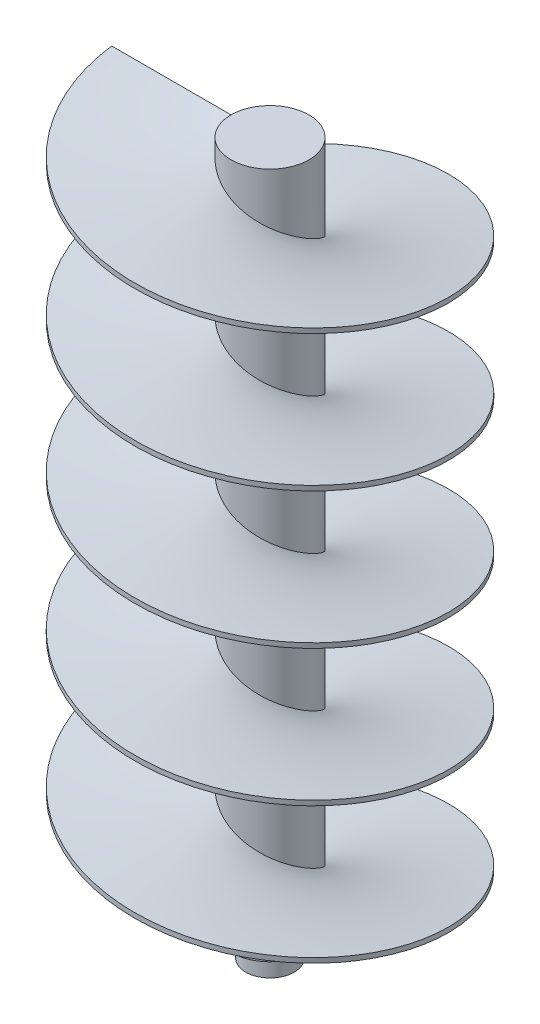
from build123d import *

# Parameters (mm, degrees)
SWEEP_1_PITCH       = 28
SWEEP_1_HEIGHT      = 140
SWEEP_1_RADIUS      = 32.5
SWEEP_1_START_ANGLE = -90
SKETCH_5_W          = 25
SKETCH_5_H          = 1
SKETCH_6_R          = 8
EXTRUDE_1_DEPTH     = 140
EXTRUDE_START       = 1
SKETCH_7_R          = 8
EXTRUDE_2_DEPTH     = 1
SKETCH_8_R          = 5
EXTRUDE_3_DEPTH     = 5


with BuildPart() as part:
    # 掃出1: sweep along a helix
    with BuildLine() as sweep_1_path:
        add(Helix(SWEEP_1_PITCH, SWEEP_1_HEIGHT, SWEEP_1_RADIUS, center=(0, 0, 0), direction=(0, 1, 0), lefthand=True, mode=Mode.PRIVATE).rotate(Axis((0, 0, 0), (0, 1, 0)), SWEEP_1_START_ANGLE))
    # 草圖5 → 掃出1 (sweep)
    with BuildSketch(Plane.XY):
        with Locations((-19.999998388, 139.498603549)):
            Rectangle(SKETCH_5_W, SKETCH_5_H)
    sweep(path=sweep_1_path.line, is_frenet=True)

    # 草圖6 → 填料-伸長1 (add)
    with BuildSketch(Plane(origin=(0, 0, 0), x_dir=(1, 0, 0), z_dir=(0, 1, 0))):
        with Locations(Location((0, 0, 0), (0, 0, 167.135626373))):
            Circle(SKETCH_6_R)
    extrude(amount=EXTRUDE_1_DEPTH)

    # 草圖7 → 填料-伸長2 (add)
    with BuildSketch(Plane.XZ.offset(EXTRUDE_START)):
        with Locations(Location((0, 0, 0), (0, 0, 180.018077006))):
            Circle(SKETCH_7_R)
    extrude(amount=-EXTRUDE_2_DEPTH)

    # 草圖8 → 填料-伸長3 (add)
    with BuildSketch(Plane.XZ.offset(1)):
        with Locations(Location((0, 0, 0), (0, 0, 270))):
            Circle(SKETCH_8_R)
    extrude(amount=EXTRUDE_3_DEPTH)


solid = part.part
